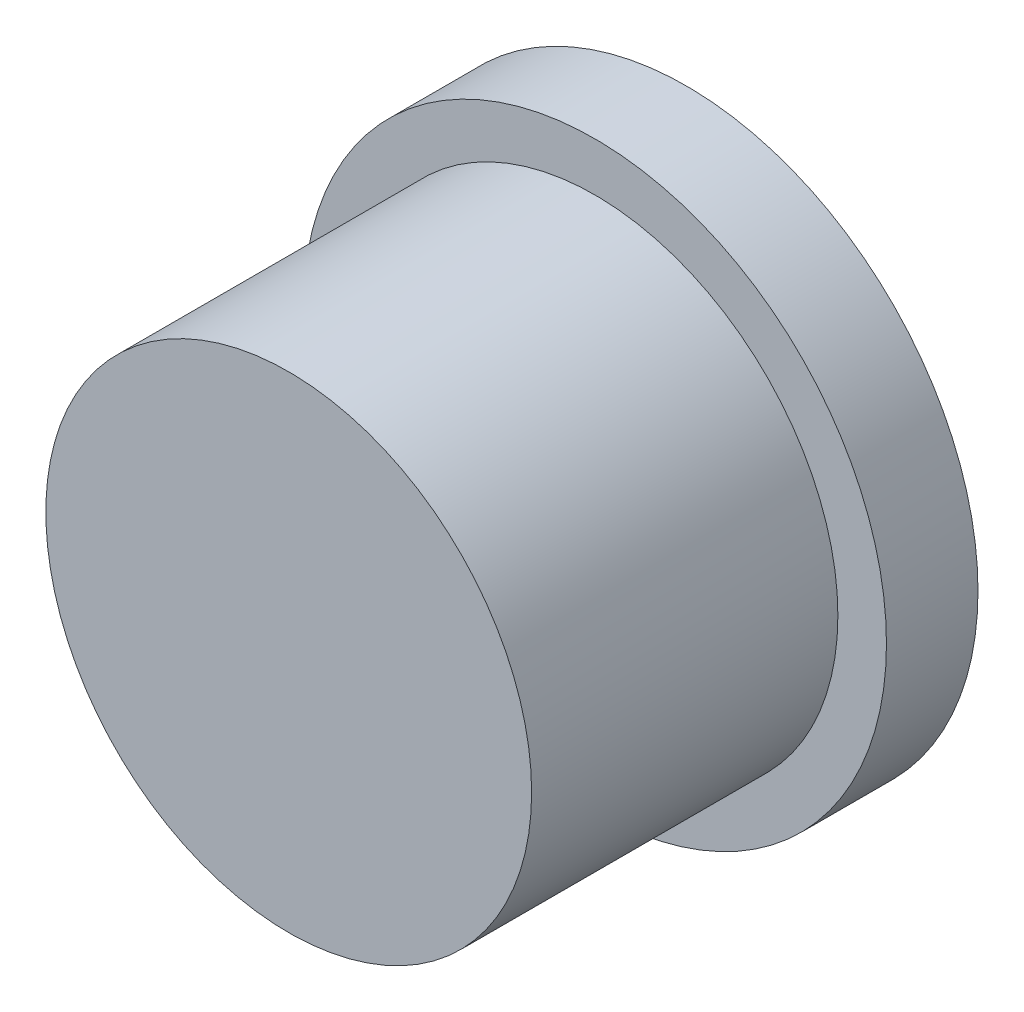
from build123d import *

# Parameters (mm, degrees)
SKETCH1_R           = 3.81
BOSS_EXTRUDE1_DEPTH = 1.19634
SKETCH2_R           = 3.175
BOSS_EXTRUDE2_DEPTH = 4.00304


with BuildPart() as part:
    # Sketch1 → Boss-Extrude1 (new body)
    with BuildSketch(Plane.XY):
        Circle(SKETCH1_R)
    extrude(amount=BOSS_EXTRUDE1_DEPTH)

    # Sketch2 → Boss-Extrude2 (add)
    with BuildSketch(Plane.XY.offset(1.19634)):
        Circle(SKETCH2_R)
    extrude(amount=BOSS_EXTRUDE2_DEPTH)


solid = part.part
